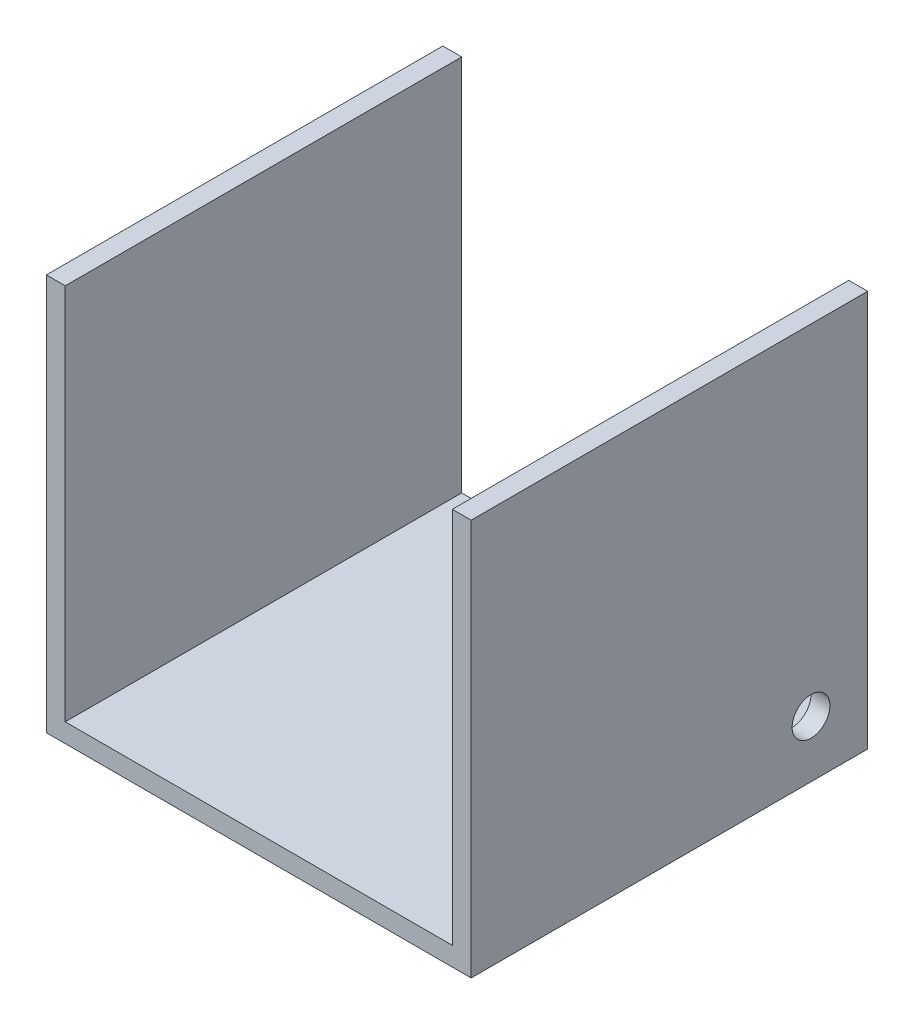
from build123d import *

# Parameters (mm, degrees)
EXTRUDE_2_DEPTH                = 210
SKETCH_3_R                     = 10
CUT_EXTRUDE_1_DEPTH            = 10
HOLE_WIZARD_M2_5_1_D           = 2.9
HOLE_WIZARD_M2_5_1_CBORE_D     = 8
HOLE_WIZARD_M2_5_1_CBORE_DEPTH = 0.5


with BuildPart() as part:
    # 草图2 → 凸台-拉伸2 (new body)
    with BuildSketch(Plane.XY):
        Polygon((0, 0), (225, 0), (225, 210), (215, 210), (215, 10), (10, 10), (10, 210), (0, 210), align=None)
    extrude(amount=-EXTRUDE_2_DEPTH)

    # 草图3 → 切除-拉伸1 (cut)
    with BuildSketch(Plane(origin=(225, 0, 0), x_dir=(0, 0, -1), z_dir=(1, 0, 0))):
        with Locations((180, 30)):
            Circle(SKETCH_3_R)
    extrude(amount=-CUT_EXTRUDE_1_DEPTH, mode=Mode.SUBTRACT)

    # M2.5 六角头螺栓的柱形沉头孔1 (through all)
    with Locations(Plane(origin=(0, 10, 0), x_dir=(1, 0, 0), z_dir=(0, 1, 0))):
        with Locations((107, 180), (107, 131.4), (165, 131.4), (165, 180)):
            CounterBoreHole(HOLE_WIZARD_M2_5_1_D / 2, HOLE_WIZARD_M2_5_1_CBORE_D / 2, HOLE_WIZARD_M2_5_1_CBORE_DEPTH)


solid = part.part
